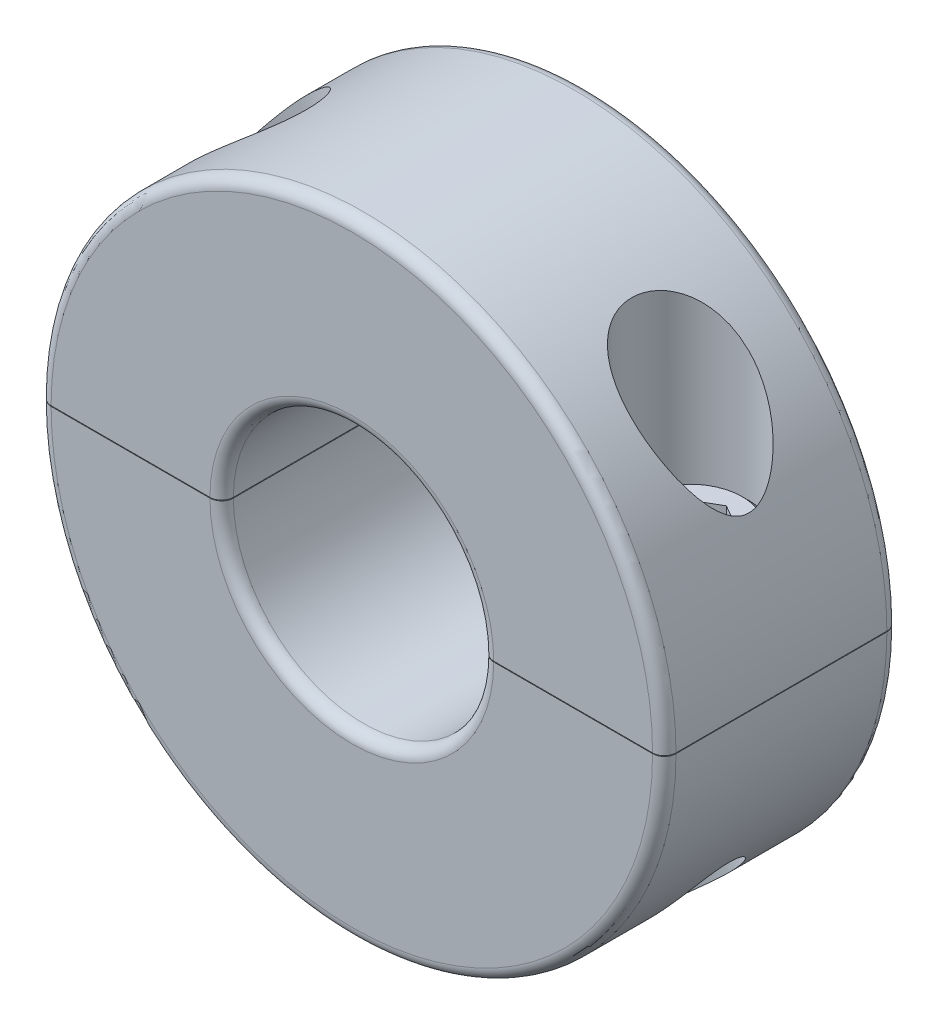
from build123d import *

# Parameters (mm, degrees)
EXTRUDE1_DEPTH     = 4.5
EXTRUDE1_2_DEPTH   = 4.5
CUT_EXTRUDE2_DEPTH = 1.5
FILLET1_R          = 0.45
FILLET2_R          = 0.45
CHAMFER1_SIZE      = 0.254
CHAMFER2_SIZE      = 0.254


with BuildPart() as part:
    # Sketch1 → Extrude1 (new, symmetric)
    with BuildSketch(Plane.XY):
        with BuildLine():
            Line((-12, 0.012), (-5, 0.012))
            ThreePointArc((-5, 0.012), (0, 5.012), (5, 0.012))
            Line((5, 0.012), (12, 0.012))
            ThreePointArc((12, 0.012), (0, 12.012), (-12, 0.012))
        make_face()
    extrude(amount=EXTRUDE1_DEPTH, both=True)


with BuildPart() as body_2:
    # Sketch1 → Extrude1 2 (new, symmetric)
    with BuildSketch(Plane.XY):
        with BuildLine():
            Line((-12, -0.012), (-5, -0.012))
            ThreePointArc((-5, -0.012), (0, -5.012), (5, -0.012))
            Line((5, -0.012), (12, -0.012))
            ThreePointArc((12, -0.012), (0, -12.012), (-12, -0.012))
        make_face()
    extrude(amount=EXTRUDE1_2_DEPTH, both=True)


with BuildPart() as cut_revolve1_tool:
    # Sketch4 → Cut-Revolve1 (revolve)
    with BuildSketch(Plane.XY):
        Polygon((-8.5, 12.012), (-6.25, 12.012), (-6.25, 0.762), (-7, 0.762), (-7, -12.012), (-8.5, -12.012), align=None)
    cut_revolve1 = revolve(axis=Axis((-8.5, -12.012, 0), (0, 1, 0)))


with BuildPart() as part_1:
    add(part.part)

    # Cut-Revolve1: cut by cut_revolve1_tool
    add(cut_revolve1_tool.part, mode=Mode.SUBTRACT)


with BuildPart() as body_2_1:
    add(body_2.part)

    # Cut-Revolve1: cut by cut_revolve1_tool
    add(cut_revolve1_tool.part, mode=Mode.SUBTRACT)


with BuildPart() as body_3:
    # Sketch6 → Revolve1 (revolve)
    with BuildSketch(Plane.XY, mode=Mode.PRIVATE) as revolve1_sk:
        Polygon((-8.5, 3.762), (-6.25, 3.762), (-6.25, 0.762), (-7, 0.762), (-7, -5.238), (-8.5, -5.238), align=None)
    revolve(revolve1_sk.sketch.rotate(Axis((-8.5, -5.238, 0), (0, 1, 0)), 90), axis=Axis((-8.5, -5.238, 0), (0, 1, 0)))

    # Sketch7 → Cut-Extrude2 (cut)
    with BuildSketch(Plane(origin=(0, 3.762, 0), x_dir=(-1, 0, 0), z_dir=(0, 1, 0))):
        Polygon((8.5, -1.385640646), (9.7, -0.692820323), (9.7, 0.692820323), (8.5, 1.385640646), (7.3, 0.692820323), (7.3, -0.692820323), align=None)
    extrude(amount=-CUT_EXTRUDE2_DEPTH, mode=Mode.SUBTRACT)


with BuildPart() as mirror1_tool:
    # Mirror1: Cut-Revolve1 across plane
    add(cut_revolve1.mirror(Plane(origin=(0, 0, 0), x_dir=(0, 0, 1), z_dir=(1, 0, 0))))


with BuildPart() as part_2:
    add(part_1.part)

    # Mirror1: cut by mirror1_tool
    add(mirror1_tool.part, mode=Mode.SUBTRACT)

    # Fillet1
    fillet1_edges = [part_2.edges().sort_by_distance(p)[0] for p in [
        (0, 5.012, 4.5),
        (0, 12.012, 4.5),
        (0, 5.012, -4.5),
        (0, 12.012, -4.5),
    ]]
    fillet(fillet1_edges, radius=FILLET1_R)


with BuildPart() as body_2_2:
    add(body_2_1.part)

    # Mirror1: cut by mirror1_tool
    add(mirror1_tool.part, mode=Mode.SUBTRACT)

    # Fillet2
    fillet2_edges = [body_2_2.edges().sort_by_distance(p)[0] for p in [
        (0, -5.012, 4.5),
        (0, -12.012, 4.5),
        (0, -5.012, -4.5),
        (0, -12.012, -4.5),
    ]]
    fillet(fillet2_edges, radius=FILLET2_R)


with BuildPart() as body_4:
    # Mirror2: mirrored copy
    add(body_3.part.mirror(Plane(origin=(0, 0, 0), x_dir=(0, 0, 1), z_dir=(1, 0, 0))))

    # Chamfer1
    chamfer1_edges = [body_4.edges().sort_by_distance(p)[0] for p in [
        (8.5, 3.762, 2.25),
    ]]
    chamfer(chamfer1_edges, length=CHAMFER1_SIZE)


with BuildPart() as body_3_1:
    add(body_3.part)

    # Chamfer2
    chamfer2_edges = [body_3_1.edges().sort_by_distance(p)[0] for p in [
        (-8.5, 3.762, 2.25),
    ]]
    chamfer(chamfer2_edges, length=CHAMFER2_SIZE)


solid = Compound([part_2.part, body_2_2.part, body_4.part, body_3_1.part])
